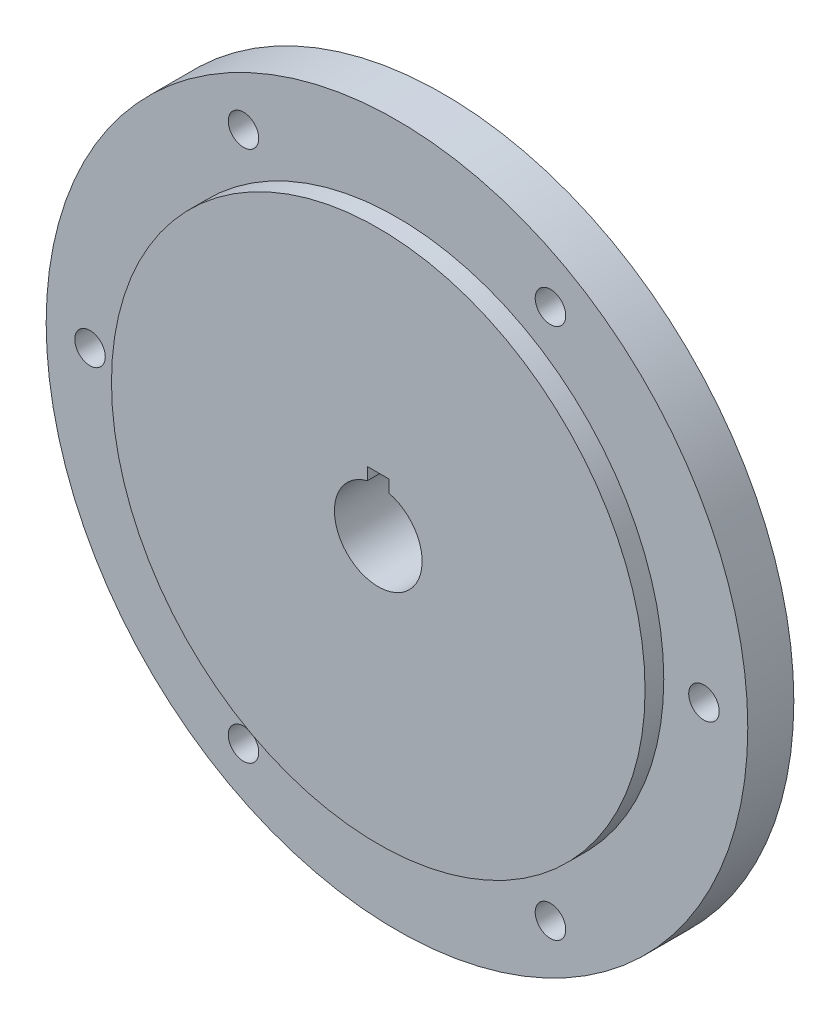
from build123d import *

# Parameters (mm, degrees)
SKETCH1_R           = 76.2
BOSS_EXTRUDE1_DEPTH = 10
SKETCH2_R           = 3.3147
CUT_EXTRUDE2_DEPTH  = 109.226059708
SKETCH4_R           = 57.9501
BOSS_EXTRUDE2_DEPTH = 4.064
SKETCH6_R           = 9.525
SKETCH6_W           = 4.7625
SKETCH6_H           = 4.7625
CUT_EXTRUDE3_DEPTH  = 109.676934517


with BuildPart() as part:
    # Sketch1 → Boss-Extrude1 (new body)
    with BuildSketch(Plane.XY):
        Circle(SKETCH1_R)
    extrude(amount=BOSS_EXTRUDE1_DEPTH)

    # Sketch2 → Cut-Extrude2 (cut, through all)
    with BuildSketch(Plane.XY):
        with Locations((66.675, 0)):
            Circle(SKETCH2_R)
        with Locations((33.3375, -57.742243797)):
            Circle(SKETCH2_R)
        with Locations((-33.3375, -57.742243797)):
            Circle(SKETCH2_R)
        with Locations((-66.675, 0)):
            Circle(SKETCH2_R)
        with Locations((-33.3375, 57.742243797)):
            Circle(SKETCH2_R)
        with Locations((33.3375, 57.742243797)):
            Circle(SKETCH2_R)
    extrude(amount=CUT_EXTRUDE2_DEPTH, mode=Mode.SUBTRACT)

    # Sketch4 → Boss-Extrude2 (add)
    with BuildSketch(Plane.XY.offset(10)):
        Circle(SKETCH4_R)
    extrude(amount=BOSS_EXTRUDE2_DEPTH)

    # Sketch6 → Cut-Extrude3 (cut, through all)
    with BuildSketch(Plane.XY.offset(14.064)):
        Circle(SKETCH6_R)
        with Locations((0, 9.525)):
            Rectangle(SKETCH6_W, SKETCH6_H)
    extrude(amount=-CUT_EXTRUDE3_DEPTH, mode=Mode.SUBTRACT)


solid = part.part
